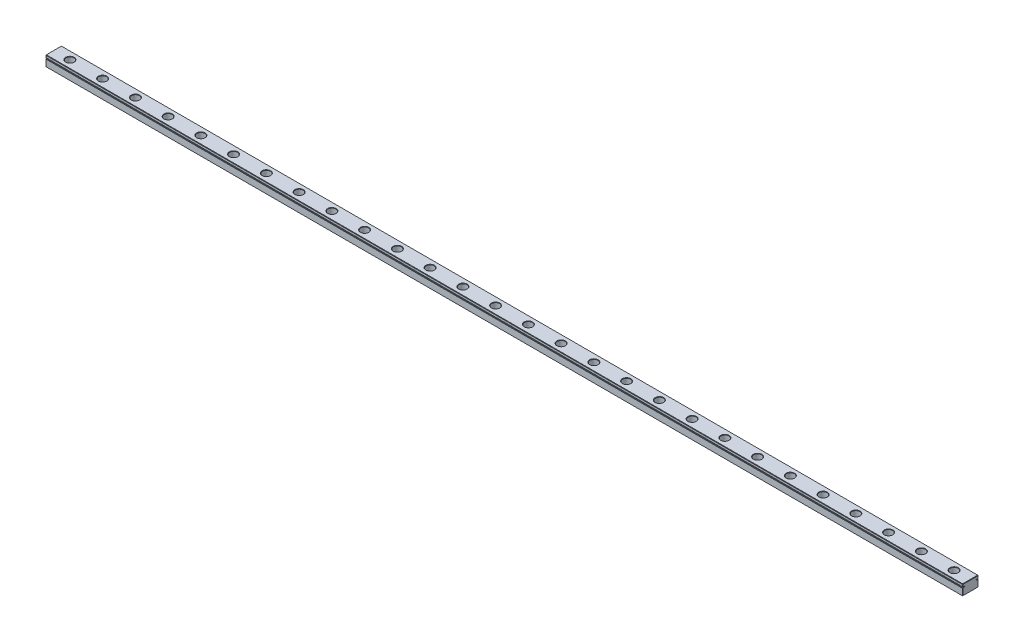
from build123d import *

# Parameters (mm, degrees)
SKETCH1_W           = 12
SKETCH1_H           = 8
BOSS_EXTRUDE1_DEPTH = 700
CUT_EXTRUDE3_REACH  = 702.037
SKETCH4_W           = 1.75
SKETCH4_H           = 0.5
SKETCH5_R           = 1.75
CUT_EXTRUDE4_DEPTH  = 701.071424927
SKETCH5_3_R         = 3
SKETCH5_3_R_2       = 1.75
CUT_EXTRUDE5_DEPTH  = 4.5
LPATTERN1_COUNT     = 14
LPATTERN1_PITCH     = 25
LPATTERN1_COL_COUNT = 15
LPATTERN1_COL_PITCH = 25
CHAMFER1_SIZE       = 0.25


with BuildPart() as part:
    # Sketch1 → Boss-Extrude1 (new body)
    with BuildSketch(Plane(origin=(0, 0, 0), x_dir=(0, 0, -1), z_dir=(1, 0, 0))):
        Rectangle(SKETCH1_W, SKETCH1_H)
    extrude(amount=BOSS_EXTRUDE1_DEPTH)

    # Sketch4 → Cut-Extrude3 (cut, up to next)
    with BuildSketch(Plane.ZY, mode=Mode.PRIVATE) as cut_extrude3_sk1:
        with Locations((-5.125, 1.75)):
            Rectangle(SKETCH4_W, SKETCH4_H)
    cut_extrude3_tool1 = extrude(cut_extrude3_sk1.sketch, amount=-CUT_EXTRUDE3_REACH, mode=Mode.PRIVATE) & part.part
    # Sketch4 → Cut-Extrude3 (cut, up to next)
    with BuildSketch(Plane.ZY, mode=Mode.PRIVATE) as cut_extrude3_sk2:
        with Locations((5.125, 1.75)):
            Rectangle(SKETCH4_W, SKETCH4_H)
    cut_extrude3_tool2 = extrude(cut_extrude3_sk2.sketch, amount=-CUT_EXTRUDE3_REACH, mode=Mode.PRIVATE) & part.part
    add(cut_extrude3_tool1.solids().sort_by_distance((0, 1.75, -5.125))[0], mode=Mode.SUBTRACT)
    add(cut_extrude3_tool2.solids().sort_by_distance((0, 1.75, 5.125))[0], mode=Mode.SUBTRACT)

    # Sketch5 → Cut-Extrude4 (cut, through all)
    with BuildSketch(Plane(origin=(0, 4, 0), x_dir=(1, 0, 0), z_dir=(0, 1, 0))):
        with Locations(Location((337.5, 0, 0), (0, 0, 270))):
            Circle(SKETCH5_R)
    cut_extrude4 = extrude(amount=-CUT_EXTRUDE4_DEPTH, mode=Mode.SUBTRACT)

    # Sketch5<3> → Cut-Extrude5 (cut)
    with BuildSketch(Plane(origin=(0, 4, 0), x_dir=(1, 0, 0), z_dir=(0, 1, 0))):
        with Locations(Location((337.5, 0, 0), (0, 0, 270))):
            Circle(SKETCH5_3_R)
        with Locations(Location((337.5, 0, 0), (0, 0, 270))):
            Circle(SKETCH5_3_R_2, mode=Mode.SUBTRACT)
    cut_extrude5 = extrude(amount=-CUT_EXTRUDE5_DEPTH, mode=Mode.SUBTRACT)

    # LPattern1: Cut-Extrude4, Cut-Extrude5 ×14
    with Locations(*[(-i * LPATTERN1_PITCH, 0, 0) for i in range(1, LPATTERN1_COUNT)]):
        add(cut_extrude4, mode=Mode.SUBTRACT)
        add(cut_extrude5, mode=Mode.SUBTRACT)

    # LPattern1 col: Cut-Extrude4, Cut-Extrude5 ×15
    with Locations(*[(i * LPATTERN1_COL_PITCH, 0, 0) for i in range(1, LPATTERN1_COL_COUNT)]):
        add(cut_extrude4, mode=Mode.SUBTRACT)
        add(cut_extrude5, mode=Mode.SUBTRACT)

    # Chamfer1
    chamfer1_edges = [part.edges().sort_by_distance(p)[0] for p in [
        (700, -1.25, -6),
        (662.5, -4, -1.75),
        (687.5, -4, -1.75),
        (312.5, -4, -1.75),
        (287.5, -4, -1.75),
        (262.5, -4, -1.75),
        (237.5, -4, -1.75),
        (212.5, -4, -1.75),
        (700, 4, 0),
        (187.5, -4, -1.75),
        (162.5, -4, -1.75),
        (0, 3, -6),
        (137.5, -4, -1.75),
        (112.5, -4, -1.75),
        (87.5, -4, -1.75),
        (62.5, -4, -1.75),
        (37.5, -4, -1.75),
        (700, 3, -6),
        (12.5, -4, -1.75),
        (362.5, 4, -3),
        (387.5, 4, -3),
        (412.5, 4, -3),
        (437.5, 4, -3),
        (350, 1.5, -6),
        (350, 2, -6),
        (462.5, 4, -3),
        (0, 1.5, -5.125),
        (487.5, 4, -3),
        (0, 1.75, -4.25),
        (0, 2, -5.125),
        (512.5, 4, -3),
        (537.5, 4, -3),
        (562.5, 4, -3),
        (587.5, 4, -3),
        (612.5, 4, -3),
        (637.5, 4, -3),
        (662.5, 4, -3),
        (687.5, 4, -3),
        (312.5, 4, -3),
        (287.5, 4, -3),
        (262.5, 4, -3),
        (237.5, 4, -3),
        (0, -1.25, 6),
        (212.5, 4, -3),
        (187.5, 4, -3),
        (162.5, 4, -3),
        (700, -1.25, 6),
        (137.5, 4, -3),
        (112.5, 4, -3),
        (87.5, 4, -3),
        (62.5, 4, -3),
        (37.5, 4, -3),
        (350, 1.5, 6),
        (12.5, 4, -3),
        (350, 2, 6),
        (0, 1.5, 5.125),
        (0, 2, 5.125),
        (0, 1.75, 4.25),
        (700, 3, 6),
        (337.5, -4, -1.75),
        (0, 4, 0),
        (337.5, 4, -3),
        (0, -1.25, -6),
        (0, -4, 0),
        (362.5, -4, -1.75),
        (0, 3, 6),
        (387.5, -4, -1.75),
        (412.5, -4, -1.75),
        (437.5, -4, -1.75),
        (700, -4, 0),
        (462.5, -4, -1.75),
        (350, 4, 6),
        (350, 4, -6),
        (487.5, -4, -1.75),
        (350, -4, -6),
        (350, -4, 6),
        (512.5, -4, -1.75),
        (537.5, -4, -1.75),
        (562.5, -4, -1.75),
        (587.5, -4, -1.75),
        (612.5, -4, -1.75),
        (637.5, -4, -1.75),
    ]]
    chamfer(chamfer1_edges, length=CHAMFER1_SIZE)


solid = part.part
